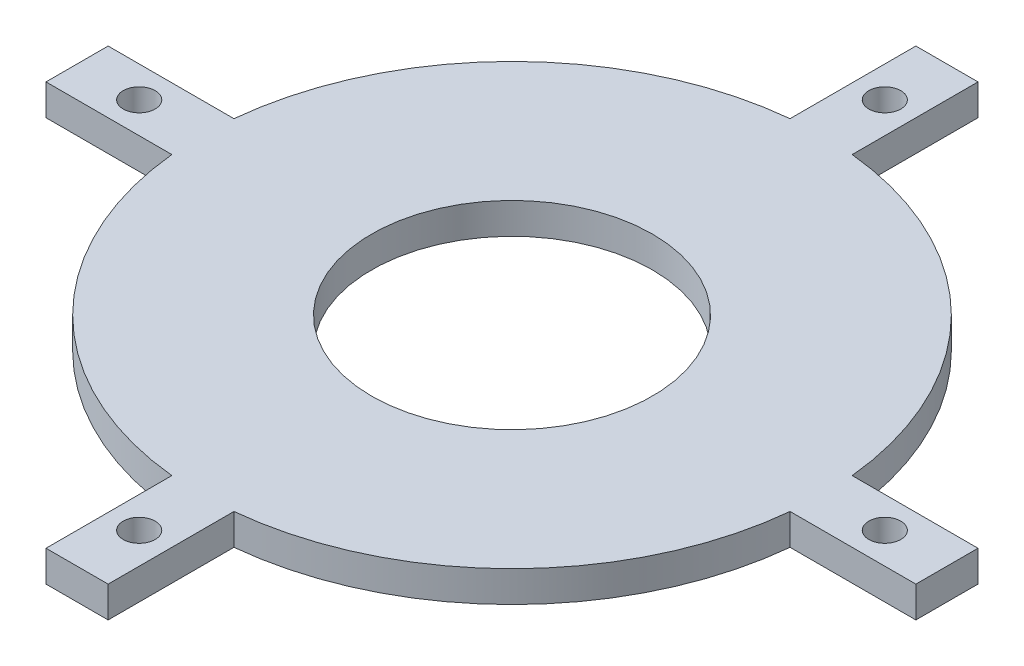
from build123d import *

# Parameters (mm, degrees)
SKETCH1_R           = 46.99
BOSS_EXTRUDE1_DEPTH = 3.175
SKETCH2_R           = 14.351
CUT_EXTRUDE1_DEPTH  = 3.175
CUT_EXTRUDE2_START  = -5.08
SKETCH5_R           = 46.99
CUT_EXTRUDE2_DEPTH  = 5.08
CIRPATTERN1_COUNT   = 4


with BuildPart() as part:
    # Sketch1 → Boss-Extrude1 (new body)
    with BuildSketch(Plane(origin=(0, 0, 0), x_dir=(1, 0, 0), z_dir=(0, 1, 0))):
        with Locations(Location((0, 0, 0), (0, 0, 270))):
            Circle(SKETCH1_R)
    extrude(amount=BOSS_EXTRUDE1_DEPTH)

    # Sketch2 → Cut-Extrude1 (cut)
    with BuildSketch(Plane(origin=(0, 3.175, 0), x_dir=(1, 0, 0), z_dir=(0, 1, 0))):
        with Locations(Location((0, 0, 0), (0, 0, 270))):
            Circle(SKETCH2_R)
    extrude(amount=-CUT_EXTRUDE1_DEPTH, mode=Mode.SUBTRACT)

    # Sketch5 → Cut-Extrude2 (cut)
    with BuildSketch(Plane(origin=(0, 3.175, 0), x_dir=(1, 0, 0), z_dir=(0, 1, 0)).offset(CUT_EXTRUDE2_START)):
        Circle(SKETCH5_R)
        with BuildLine():
            Line((31.590851128, 3.175), (44.45, 3.175))
            Line((44.45, 3.175), (44.45, -3.175))
            Line((44.45, -3.175), (31.590851128, -3.175))
            ThreePointArc((31.590851128, -3.175), (22.450640303, -22.450640303), (3.175, -31.590851128))
            Line((3.175, -31.590851128), (3.175, -44.45))
            Line((3.175, -44.45), (-3.175, -44.45))
            Line((-3.175, -44.45), (-3.175, -31.590851128))
            ThreePointArc((-3.175, -31.590851128), (-22.450640303, -22.450640303), (-31.590851128, -3.175))
            Line((-31.590851128, -3.175), (-44.45, -3.175))
            Line((-44.45, -3.175), (-44.45, 3.175))
            Line((-44.45, 3.175), (-31.590851128, 3.175))
            ThreePointArc((-31.590851128, 3.175), (-22.450640303, 22.450640303), (-3.175, 31.590851128))
            Line((-3.175, 31.590851128), (-3.175, 44.45))
            Line((-3.175, 44.45), (3.175, 44.45))
            Line((3.175, 44.45), (3.175, 31.590851128))
            ThreePointArc((3.175, 31.590851128), (22.450640303, 22.450640303), (31.590851128, 3.175))
        make_face(mode=Mode.SUBTRACT)
    extrude(amount=CUT_EXTRUDE2_DEPTH, mode=Mode.SUBTRACT)

    # Sketch6 → #4 Clearance Hole1 (revolve, cut)
    with BuildSketch(Plane(origin=(0, 3.175, -38.1), x_dir=(0, 0, 1), z_dir=(1, 0, 0))):
        Polygon((0, 0), (0, 11.140574487), (1.63195, 10.16), (1.63195, 0), align=None)
    f_4_clearance_hole1 = revolve(axis=Axis((0, 9.525, -38.1), (0, -1, 0)), mode=Mode.SUBTRACT)

    # CirPattern1: #4 Clearance Hole1 ×4 about axis
    cirpattern1_axis = Axis((0, 0, 0), (0, 1, 0))
    for i in range(1, CIRPATTERN1_COUNT):
        add(f_4_clearance_hole1.rotate(cirpattern1_axis, i * 360 / CIRPATTERN1_COUNT), mode=Mode.SUBTRACT)


solid = part.part
